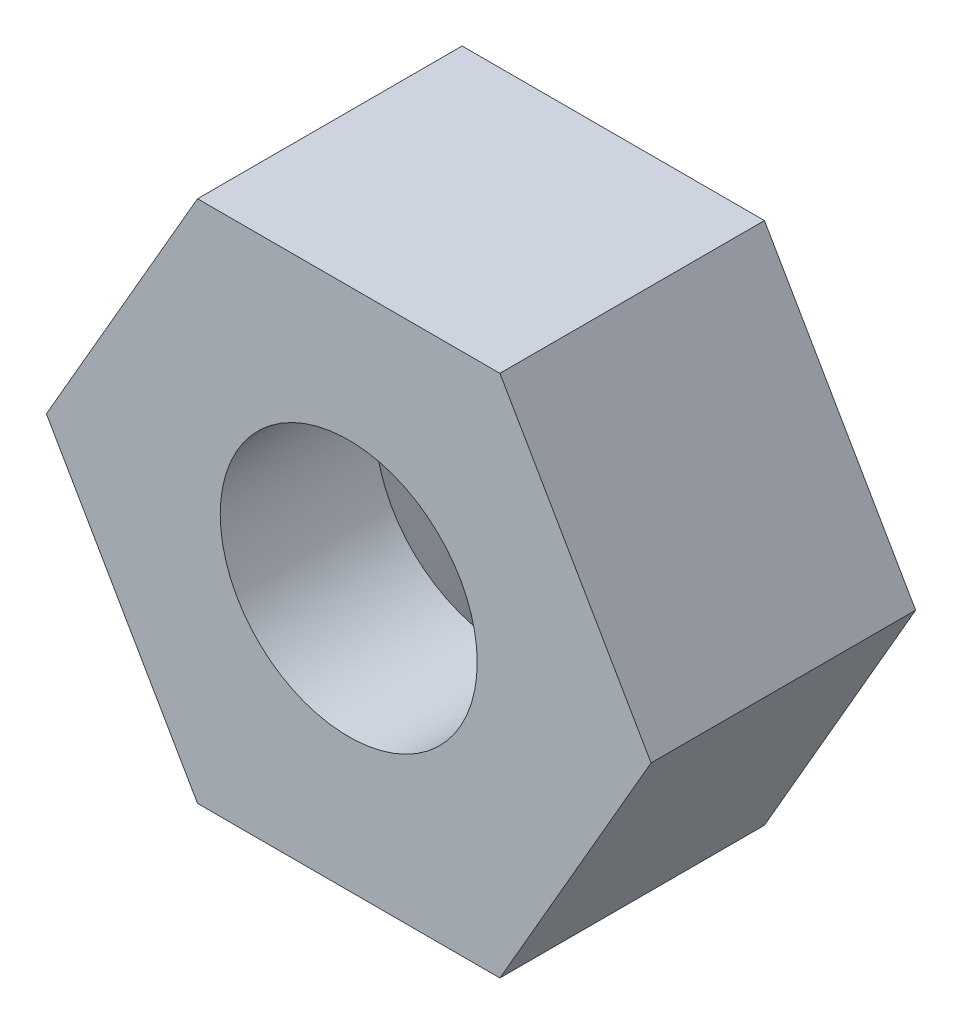
from build123d import *

# Parameters (mm, degrees)
BOSS_EXTRUDE1_DEPTH                                 = 1.75
CSK_FOR_M3_COUNTERSUNK_FLAT_HEAD_SCREW1_D           = 3.4
CSK_FOR_M3_COUNTERSUNK_FLAT_HEAD_SCREW1_DEPTH       = 3.5
CSK_FOR_M3_COUNTERSUNK_FLAT_HEAD_SCREW1_CSINK_D     = 6.3
CSK_FOR_M3_COUNTERSUNK_FLAT_HEAD_SCREW1_CSINK_ANGLE = 90
CSK_FOR_M3_COUNTERSUNK_FLAT_HEAD_SCREW1_TIP         = 1.021463052


with BuildPart() as part:
    # Sketch1 → Boss-Extrude1 (new, symmetric)
    with BuildSketch(Plane.XY):
        Polygon((2, -3.464101615), (4, 0), (2, 3.464101615), (-2, 3.464101615), (-4, 0), (-2, -3.464101615), align=None)
    extrude(amount=BOSS_EXTRUDE1_DEPTH, both=True)

    # CSK for M3 Countersunk Flat Head Screw1
    with Locations(Plane(origin=(0, 0, -1.75), x_dir=(-1, 0, 0), z_dir=(0, 0, -1))):
        with Locations((0, 0)):
            CounterSinkHole(CSK_FOR_M3_COUNTERSUNK_FLAT_HEAD_SCREW1_D / 2, CSK_FOR_M3_COUNTERSUNK_FLAT_HEAD_SCREW1_CSINK_D / 2, depth=CSK_FOR_M3_COUNTERSUNK_FLAT_HEAD_SCREW1_DEPTH, counter_sink_angle=CSK_FOR_M3_COUNTERSUNK_FLAT_HEAD_SCREW1_CSINK_ANGLE)
            with Locations((0, 0, -(CSK_FOR_M3_COUNTERSUNK_FLAT_HEAD_SCREW1_DEPTH + CSK_FOR_M3_COUNTERSUNK_FLAT_HEAD_SCREW1_TIP / 2))):  # 118° drill point
                Cone(0, CSK_FOR_M3_COUNTERSUNK_FLAT_HEAD_SCREW1_D / 2, CSK_FOR_M3_COUNTERSUNK_FLAT_HEAD_SCREW1_TIP, mode=Mode.SUBTRACT)


solid = part.part
